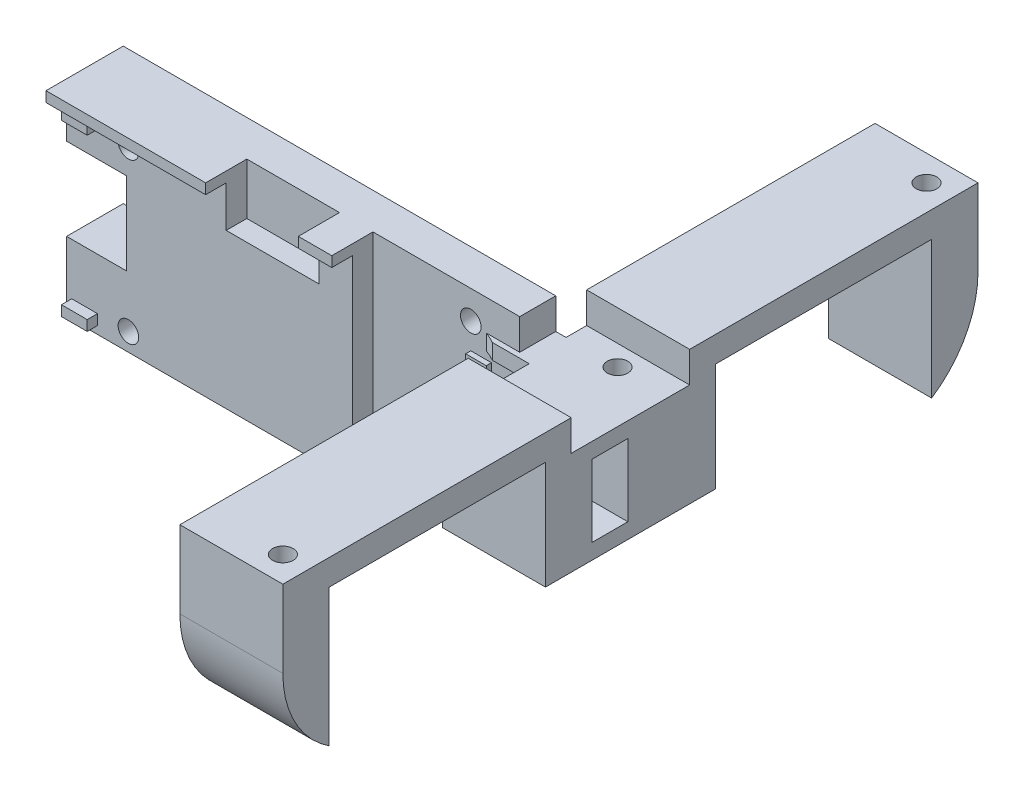
from build123d import *

# Parameters (mm, degrees)
BOSS_EXTRUDE1_DEPTH      = 35
CUT_EXTRUDE1_REACH       = 164.604
SKETCH2_W                = 42
SKETCH2_H                = 21
SKETCH3_R                = 2
CUT_EXTRUDE2_DEPTH       = 10
FILLET1_R                = 20
CUT_EXTRUDE5_REACH       = 164.604
SKETCH6_W                = 42
SKETCH6_H                = 9
CUT_EXTRUDE7_DEPTH       = 9
SKETCH9_R                = 2
CUT_EXTRUDE8_DEPTH       = 10
CUT_EXTRUDE9_DEPTH       = 6
SKETCH11_R               = 2
CUT_EXTRUDE10_DEPTH      = 9
SKETCH12_R               = 2
CUT_EXTRUDE11_DEPTH      = 10
SKETCH14_W               = 85
SKETCH14_H               = 33
CUT_EXTRUDE13_DEPTH      = 4
SKETCH15_W               = 28
SKETCH15_H               = 20
CUT_EXTRUDE14_DEPTH      = 4
BOSS_EXTRUDE2_DEPTH      = 5
BOSS_EXTRUDE2_DEPTH_BACK = 9
SKETCH16_W               = 80
SKETCH16_H               = 11
SKETCH13_R               = 2
CUT_EXTRUDE12_DEPTH      = 12
FILLET2_R                = 2
SKETCH17_W               = 28.5
SKETCH17_H               = 40
SKETCH17_W_2             = 18
SKETCH17_H_2             = 10
CUT_EXTRUDE15_DEPTH      = 8
CUT_EXTRUDE18_REACH      = 104.86
SKETCH20_W               = 8
SKETCH20_H               = 16
SKETCH7_R                = 2
CUT_EXTRUDE6_DEPTH       = 13
CHAMFER1_SIZE            = 10
CHAMFER1_SIZE2           = 3.639702343
CUT_EXTRUDE19_REACH      = 164.604
SKETCH22_W               = 7
SKETCH22_H               = 14
BOSS_EXTRUDE4_REACH      = 141.461
BOSS_EXTRUDE5_START      = -3
BOSS_EXTRUDE5_DEPTH      = 3
CUT_EXTRUDE21_DEPTH      = 140.460664257
SKETCH27_W               = 7.175165893
SKETCH27_H               = 9
CUT_EXTRUDE22_DEPTH      = 140.460664257
SKETCH28_W               = 5
SKETCH28_H               = 2
BOSS_EXTRUDE6_DEPTH      = 2
SKETCH29_W               = 4
SKETCH29_H               = 8
BOSS_EXTRUDE7_DEPTH      = 1
SKETCH30_W               = 3
SKETCH30_H               = 7
BOSS_EXTRUDE8_DEPTH      = 2


with BuildPart() as part:
    # Sketch1 → Boss-Extrude1 (new body)
    with BuildSketch(Plane(origin=(0, 0, 0), x_dir=(1, 0, 0), z_dir=(0, 1, 0))):
        Polygon((-40.317617866, 43.23325062), (45.682382134, 43.23325062), (45.682382134, -16.76674938), (65.682382134, -16.76674938), (65.682382134, 118.23325062), (45.682382134, 118.23325062), (45.682382134, 58.23325062), (-40.317617866, 58.23325062), align=None)
    extrude(amount=BOSS_EXTRUDE1_DEPTH)

    # Sketch2 → Cut-Extrude1 (cut, up to next)
    with BuildSketch(Plane(origin=(65.682382134, 0, 0), x_dir=(0, 0, -1), z_dir=(1, 0, 0)), mode=Mode.PRIVATE) as cut_extrude1_sk1:
        with Locations((13.23325062, 19.5)):
            Rectangle(SKETCH2_W, SKETCH2_H)
    cut_extrude1_tool1 = extrude(cut_extrude1_sk1.sketch, amount=-CUT_EXTRUDE1_REACH, mode=Mode.PRIVATE) & part.part
    # Sketch2 → Cut-Extrude1 (cut, up to next)
    with BuildSketch(Plane(origin=(65.682382134, 0, 0), x_dir=(0, 0, -1), z_dir=(1, 0, 0)), mode=Mode.PRIVATE) as cut_extrude1_sk2:
        with Locations((88.23325062, 19.5)):
            Rectangle(SKETCH2_W, SKETCH2_H)
    cut_extrude1_tool2 = extrude(cut_extrude1_sk2.sketch, amount=-CUT_EXTRUDE1_REACH, mode=Mode.PRIVATE) & part.part
    add(cut_extrude1_tool1.solids().sort_by_distance((65.682382, 19.5, -13.233251))[0], mode=Mode.SUBTRACT)
    add(cut_extrude1_tool2.solids().sort_by_distance((65.682382, 19.5, -88.233251))[0], mode=Mode.SUBTRACT)

    # Sketch3 → Cut-Extrude2 (cut)
    with BuildSketch(Plane.ZY.offset(-45.682382134)):
        with Locations((11.26674938, 24.75)):
            Circle(SKETCH3_R)
        with Locations((11.26674938, 15.25)):
            Circle(SKETCH3_R)
        with Locations((-37.73325062, 24.75)):
            Circle(SKETCH3_R)
        with Locations((-37.73325062, 15.25)):
            Circle(SKETCH3_R)
        with Locations(Location((-112.73325062, 24.75, 0), (0, 0, 180))):
            Circle(SKETCH3_R)
        with Locations(Location((-112.73325062, 15.25, 0), (0, 0, 180))):
            Circle(SKETCH3_R)
        with Locations(Location((-63.73325062, 15.25, 0), (0, 0, 180))):
            Circle(SKETCH3_R)
        with Locations(Location((-63.73325062, 24.75, 0), (0, 0, 180))):
            Circle(SKETCH3_R)
    extrude(amount=-CUT_EXTRUDE2_DEPTH, mode=Mode.SUBTRACT)

    # Fillet1
    fillet1_edges = [part.edges().sort_by_distance(p)[0] for p in [
        (55.682382134, 0, -118.23325062),
        (55.682382134, 0, 16.76674938),
    ]]
    fillet(fillet1_edges, radius=FILLET1_R)

    # Sketch6 → Cut-Extrude5 (cut, up to next)
    with BuildSketch(Plane(origin=(65.682382134, 0, 0), x_dir=(0, 0, -1), z_dir=(1, 0, 0)), mode=Mode.PRIVATE) as cut_extrude5_sk1:
        with Locations((13.23325062, 4.5)):
            Rectangle(SKETCH6_W, SKETCH6_H)
    cut_extrude5_tool1 = extrude(cut_extrude5_sk1.sketch, amount=-CUT_EXTRUDE5_REACH, mode=Mode.PRIVATE) & part.part
    # Sketch6 → Cut-Extrude5 (cut, up to next)
    with BuildSketch(Plane(origin=(65.682382134, 0, 0), x_dir=(0, 0, -1), z_dir=(1, 0, 0)), mode=Mode.PRIVATE) as cut_extrude5_sk2:
        with Locations((88.23325062, 4.5)):
            Rectangle(SKETCH6_W, SKETCH6_H)
    cut_extrude5_tool2 = extrude(cut_extrude5_sk2.sketch, amount=-CUT_EXTRUDE5_REACH, mode=Mode.PRIVATE) & part.part
    add(cut_extrude5_tool1.solids().sort_by_distance((65.682382, 4.5, -13.233251))[0], mode=Mode.SUBTRACT)
    add(cut_extrude5_tool2.solids().sort_by_distance((65.682382, 4.5, -88.233251))[0], mode=Mode.SUBTRACT)

    # Sketch8 → Cut-Extrude7 (cut)
    with BuildSketch(Plane.XZ):
        Polygon((45.682382134, -67.23325062), (45.682382134, -58.23325062), (25.682382134, -58.23325062), (25.682382134, -43.23325062), (45.682382134, -43.23325062), (45.682382134, -34.23325062), (65.682382134, -34.23325062), (65.682382134, -67.23325062), align=None)
    extrude(amount=-CUT_EXTRUDE7_DEPTH, mode=Mode.SUBTRACT)

    # Sketch9 → Cut-Extrude8 (cut)
    with BuildSketch(Plane.XZ.offset(-9)):
        with Locations(Location((55.682382134, -42.23325062, 0), (0, 0, 270))):
            Circle(SKETCH9_R)
        with Locations(Location((55.682382134, -59.23325062, 0), (0, 0, 270))):
            Circle(SKETCH9_R)
    extrude(amount=-CUT_EXTRUDE8_DEPTH, mode=Mode.SUBTRACT)

    # Sketch10 → Cut-Extrude9 (cut)
    with BuildSketch(Plane(origin=(0, 35, 0), x_dir=(1, 0, 0), z_dir=(0, 1, 0))):
        Polygon((45.682382134, 62.23325062), (65.682382134, 62.23325062), (65.682382134, 39.23325062), (45.682382134, 39.23325062), (45.682382134, 43.23325062), (43.682382134, 43.23325062), (43.682382134, 58.23325062), (45.682382134, 58.23325062), align=None)
    extrude(amount=-CUT_EXTRUDE9_DEPTH, mode=Mode.SUBTRACT)

    # Sketch11 → Cut-Extrude10 (cut)
    with BuildSketch(Plane(origin=(0, 29, 0), x_dir=(1, 0, 0), z_dir=(0, 1, 0))):
        with Locations(Location((55.682382134, 58.23325062, 0), (0, 0, 270))):
            Circle(SKETCH11_R)
        with Locations(Location((55.682382134, 43.23325062, 0), (0, 0, 270))):
            Circle(SKETCH11_R)
    extrude(amount=-CUT_EXTRUDE10_DEPTH, mode=Mode.SUBTRACT)

    # Sketch12 → Cut-Extrude11 (cut)
    with BuildSketch(Plane(origin=(0, 35, 0), x_dir=(1, 0, 0), z_dir=(0, 1, 0))):
        with Locations(Location((60.682382134, -11.76674938, 0), (0, 0, 270))):
            Circle(SKETCH12_R)
        with Locations(Location((60.682382134, 113.23325062, 0), (0, 0, 270))):
            Circle(SKETCH12_R)
    extrude(amount=-CUT_EXTRUDE11_DEPTH, mode=Mode.SUBTRACT)

    # Sketch14 → Cut-Extrude13 (cut)
    with BuildSketch(Plane.XY.offset(-43.23325062)):
        with Locations((2.182382134, 16.5)):
            Rectangle(SKETCH14_W, SKETCH14_H)
    extrude(amount=-CUT_EXTRUDE13_DEPTH, mode=Mode.SUBTRACT)

    # Sketch15 → Cut-Extrude14 (cut)
    with BuildSketch(Plane.XY.offset(-47.23325062)):
        with Locations((29.682382134, 10)):
            Rectangle(SKETCH15_W, SKETCH15_H)
    extrude(amount=-CUT_EXTRUDE14_DEPTH, mode=Mode.SUBTRACT)

    # Sketch16 → Boss-Extrude2 (add, two sides: drawn at the far end of the back side and taken through both)
    with BuildSketch(Plane.XZ.offset(-BOSS_EXTRUDE2_DEPTH_BACK)):
        with Locations((-0.317617866, -52.73325062)):
            Rectangle(SKETCH16_W, SKETCH16_H)
    extrude(amount=BOSS_EXTRUDE2_DEPTH + BOSS_EXTRUDE2_DEPTH_BACK)

    # Sketch13 → Cut-Extrude12 (cut)
    with BuildSketch(Plane.XY.offset(-43.23325062)):
        with Locations((-28.317617866, 29.5)):
            Circle(SKETCH13_R)
        with Locations((34.182382134, 29.5)):
            Circle(SKETCH13_R)
        with Locations((34.182382134, -1.5)):
            Circle(SKETCH13_R)
        with Locations((-28.317617866, -1.5)):
            Circle(SKETCH13_R)
    extrude(amount=-CUT_EXTRUDE12_DEPTH, mode=Mode.SUBTRACT)

    # Fillet2
    fillet2_edges = [part.edges().sort_by_distance(p)[0] for p in [
        (39.682382134, -5, -52.73325062),
    ]]
    fillet(fillet2_edges, radius=FILLET2_R)

    # Sketch17 → Cut-Extrude15 (cut)
    with BuildSketch(Plane.XY.offset(-43.23325062)):
        with Locations((29.432382134, 15)):
            Rectangle(SKETCH17_W, SKETCH17_H)
        with Locations((-0.317617866, 30)):
            Rectangle(SKETCH17_W_2, SKETCH17_H_2)
    extrude(amount=-CUT_EXTRUDE15_DEPTH, mode=Mode.SUBTRACT)

    # Sketch20 → Cut-Extrude18 (cut, up to next)
    with BuildSketch(Plane.XY.offset(-47.23325062), mode=Mode.PRIVATE) as cut_extrude18_sk1:
        with Locations((-36.317617866, 16.5)):
            Rectangle(SKETCH20_W, SKETCH20_H)
    cut_extrude18_tool1 = extrude(cut_extrude18_sk1.sketch, amount=-CUT_EXTRUDE18_REACH, mode=Mode.PRIVATE) & part.part
    add(cut_extrude18_tool1.solids().sort_by_distance((-36.317618, 16.5, -47.233251))[0], mode=Mode.SUBTRACT)

    # Sketch7 → Cut-Extrude6 (cut)
    with BuildSketch(Plane.ZY.offset(40.317617866)):
        with Locations((-50.73325062, 28.5)):
            Circle(SKETCH7_R)
        with Locations((-50.73325062, 5)):
            Circle(SKETCH7_R)
    extrude(amount=-CUT_EXTRUDE6_DEPTH, mode=Mode.SUBTRACT)

    # Chamfer1
    chamfer1_edges = [part.edges().sort_by_distance(p)[0] for p in [
        (-32.317617866, 16.5, -47.23325062),
    ]]
    chamfer1_side = [part.faces().sort_by_distance(p)[0] for p in [
        (-32.317617866, 16.5, -52.73325062),
    ]]
    chamfer(chamfer1_edges, length=CHAMFER1_SIZE, length2=CHAMFER1_SIZE2, reference=chamfer1_side[0])

    # Sketch22 → Cut-Extrude19 (cut, up to next)
    with BuildSketch(Plane(origin=(65.682382134, 0, 0), x_dir=(0, 0, -1), z_dir=(1, 0, 0)), mode=Mode.PRIVATE) as cut_extrude19_sk1:
        with Locations((46.73325062, 19)):
            Rectangle(SKETCH22_W, SKETCH22_H)
    cut_extrude19_tool1 = extrude(cut_extrude19_sk1.sketch, amount=-CUT_EXTRUDE19_REACH, mode=Mode.PRIVATE) & part.part
    add(cut_extrude19_tool1.solids().sort_by_distance((65.682382, 19, -46.733251))[0], mode=Mode.SUBTRACT)

    # Boss-Extrude4: up to this face of the body (flat: up to its plane)
    boss_extrude4_end = Plane(part.part.faces().sort_by_distance((54.930904304, 26, -46.8909066))[0])
    # Sketch24 → Boss-Extrude4 (add, up to the picked face)
    with BuildSketch(Plane(origin=(0, 29, 0), x_dir=(1, 0, 0), z_dir=(0, 1, 0)), mode=Mode.PRIVATE) as boss_extrude4_sk1:
        with BuildLine():
            Line((37.182382134, 51.23325062), (45.682382134, 51.23325062))
            Line((45.682382134, 51.23325062), (45.682382134, 39.23325062))
            ThreePointArc((45.682382134, 39.23325062), (43.342105313, 46.585971205), (37.182382134, 51.23325062))
        make_face()
    boss_extrude4_tool1 = split(extrude(boss_extrude4_sk1.sketch, amount=-BOSS_EXTRUDE4_REACH, mode=Mode.PRIVATE), bisect_by=boss_extrude4_end, keep=Keep.BOTH, mode=Mode.PRIVATE)
    add(boss_extrude4_tool1.solids().sort_by(Axis((43.397163, 29, -48.466484), (0, -1, 0)))[0])

    # Sketch25 → Boss-Extrude5 (add)
    with BuildSketch(Plane.XZ.offset(-9).offset(BOSS_EXTRUDE5_START)):
        with BuildLine():
            Line((37.182382134, -51.23325062), (45.682382134, -51.23325062))
            Line((45.682382134, -51.23325062), (45.682382134, -39.23325062))
            ThreePointArc((45.682382134, -39.23325062), (43.342105313, -46.585971205), (37.182382134, -51.23325062))
        make_face()
    extrude(amount=BOSS_EXTRUDE5_DEPTH)

    # Sketch26 → Cut-Extrude21 (cut, through all)
    with BuildSketch(Plane(origin=(0, 29, 0), x_dir=(1, 0, 0), z_dir=(0, 1, 0))):
        with BuildLine():
            Line((45.239754001, 42.559669232), (43.686053775, 42.559669232))
            Line((43.686053775, 42.559669232), (44.063234426, 45.443837008))
            ThreePointArc((44.063234426, 45.443837008), (44.740108693, 44.037901041), (45.239754001, 42.559669232))
        make_face()
    extrude(amount=-CUT_EXTRUDE21_DEPTH, mode=Mode.SUBTRACT)

    # Sketch27 → Cut-Extrude22 (cut, through all)
    with BuildSketch(Plane(origin=(0, 29, 0), x_dir=(1, 0, 0), z_dir=(0, 1, 0))):
        with Locations((42.937910719, 45.73325062)):
            Rectangle(SKETCH27_W, SKETCH27_H)
    extrude(amount=-CUT_EXTRUDE22_DEPTH, mode=Mode.SUBTRACT)

    # Sketch28 → Boss-Extrude6 (add)
    with BuildSketch(Plane.XY.offset(-47.23325062)):
        with Locations((-36.817617866, 30.5)):
            Rectangle(SKETCH28_W, SKETCH28_H)
        with Locations((-36.817617866, -2.5)):
            Rectangle(SKETCH28_W, SKETCH28_H)
    extrude(amount=BOSS_EXTRUDE6_DEPTH)

    # Sketch29 → Boss-Extrude7 (add)
    with BuildSketch(Plane.XY.offset(-51.23325062)):
        with Locations((36.182382134, 20.5)):
            Rectangle(SKETCH29_W, SKETCH29_H)
    extrude(amount=BOSS_EXTRUDE7_DEPTH)

    # Sketch30 → Boss-Extrude8 (add)
    with BuildSketch(Plane.XY.offset(-51.23325062)):
        with Locations((35.182382134, 8)):
            Rectangle(SKETCH30_W, SKETCH30_H)
    extrude(amount=BOSS_EXTRUDE8_DEPTH)


solid = part.part
